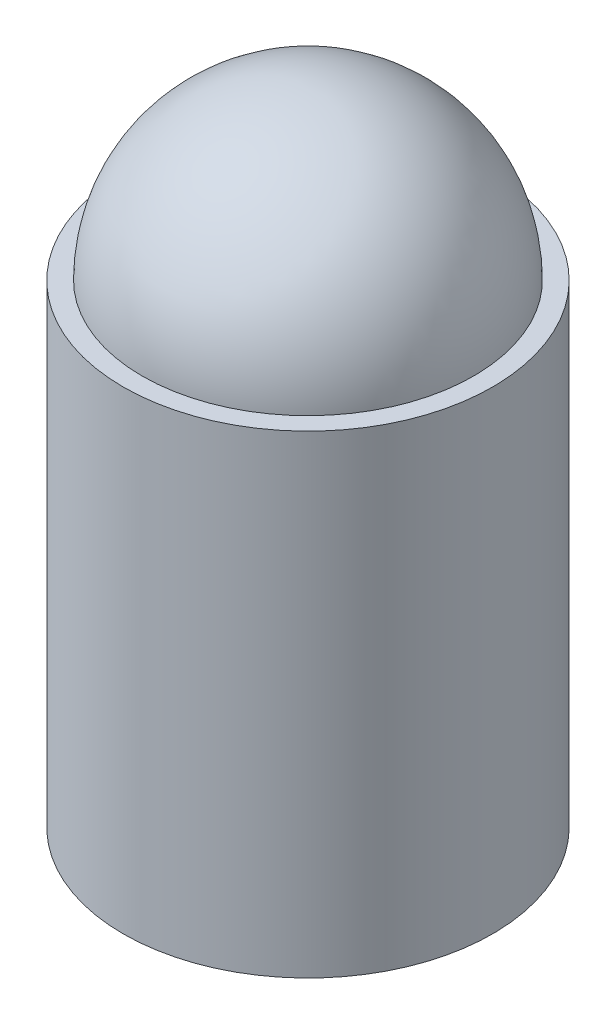
from build123d import *

# Parameters (mm, degrees)
SKETCH2_R           = 4.953
BOSS_EXTRUDE1_DEPTH = 12.7


with BuildPart() as part:
    # Sketch1 → Revolve4 (revolve)
    with BuildSketch(Plane(origin=(0, 0, 0), x_dir=(1, 0, 0), z_dir=(0, 1, 0))):
        with BuildLine():
            Line((-4.445, 0), (4.445, 0))
            ThreePointArc((4.445, 0), (0, -4.445), (-4.445, 0))
        make_face()
    revolve(axis=Axis((-4.445, 0, 0), (1, 0, 0)))

    # Sketch2 → Boss-Extrude1 (add)
    with BuildSketch(Plane(origin=(0, 0, 0), x_dir=(1, 0, 0), z_dir=(0, 1, 0))):
        with Locations(Location((0, 0, 0), (0, 0, 270))):
            Circle(SKETCH2_R)
    extrude(amount=-BOSS_EXTRUDE1_DEPTH)


solid = part.part
